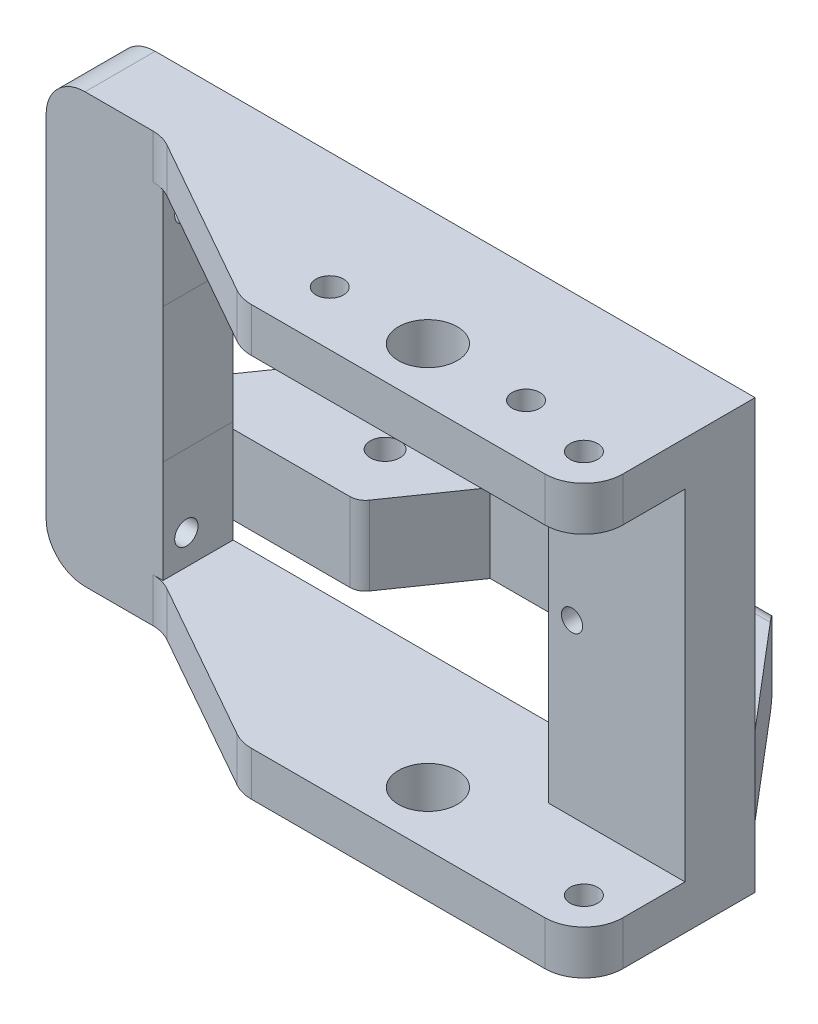
from build123d import *

# Parameters (mm, degrees)
SKETCH1_W               = 114.3
SKETCH1_H               = 69.85
BOSS_EXTRUDE1_DEPTH     = 57.15
SKETCH2_W               = 114.3
SKETCH2_H               = 55.450000124
CUT_EXTRUDE2_DEPTH      = 25.4
SKETCH3_W               = 114.3
SKETCH3_H               = 46.99
CUT_EXTRUDE3_DEPTH      = 20.32
CUT_EXTRUDE6_REACH      = 108.824
SKETCH7_R               = 4.8
CUT_EXTRUDE7_DEPTH      = 75.121121315
CUT_EXTRUDE7_DEPTH_BACK = 75.121121315
SKETCH9_W               = 62.865
SKETCH9_H               = 55.450000124
SKETCH9_W_2             = 19.05
SKETCH9_H_2             = 69.85
CUT_EXTRUDE8_REACH      = 108.824
SKETCH8_R               = 2.25
SKETCH12_R              = 1.905
CUT_EXTRUDE10_DEPTH     = 19.05
SKETCH13_W              = 95.25
SKETCH13_H              = 8.925763794
CUT_EXTRUDE12_DEPTH     = 107.823534392
BOSS_EXTRUDE2_REACH     = 103.269
SKETCH14_W              = 20.32
SKETCH14_H              = 15.660000062
SKETCH5_R               = 2.415
CUT_EXTRUDE20_DEPTH     = 103.326545714
SKETCH18_W              = 20.32
SKETCH18_H              = 10.024904341
CUT_EXTRUDE21_DEPTH     = 113.329404355
BOSS_EXTRUDE4_DEPTH     = 8.89
F_8_CLEARANCE_HOLE1_D   = 4.4958
F_8_32_TAPPED_HOLE1_D   = 3.4544
SKETCH40_W              = 104.14
SKETCH40_H              = 12.835095659
CUT_EXTRUDE22_DEPTH     = 1.27
CUT_EXTRUDE24_DEPTH     = 108.544786288
FILLET3_R               = 6.35
CUT_EXTRUDE25_DEPTH     = 102.320780831
FILLET4_R               = 2.54


with BuildPart() as part:
    # Sketch1 → Boss-Extrude1 (new body)
    with BuildSketch(Plane.XY):
        Rectangle(SKETCH1_W, SKETCH1_H)
    extrude(amount=BOSS_EXTRUDE1_DEPTH)

    # Sketch2 → Cut-Extrude2 (cut)
    with BuildSketch(Plane.XY.offset(57.15)):
        Rectangle(SKETCH2_W, SKETCH2_H)
    extrude(amount=-CUT_EXTRUDE2_DEPTH, mode=Mode.SUBTRACT)

    # Sketch3 → Cut-Extrude3 (cut)
    with BuildSketch(Plane(origin=(0, 0, 0), x_dir=(-1, 0, 0), z_dir=(0, 0, -1))):
        with Locations((0, 11.43)):
            Rectangle(SKETCH3_W, SKETCH3_H)
    extrude(amount=-CUT_EXTRUDE3_DEPTH, mode=Mode.SUBTRACT)

    # Cut-Extrude6: up to this face of the body (flat: up to its plane)
    cut_extrude6_end = Plane(part.part.faces().sort_by_distance((0, 34.925, 38.735))[0])
    # Sketch7 → Cut-Extrude6 (cut, up to the picked face)
    with BuildSketch(Plane.XZ.offset(34.925), mode=Mode.PRIVATE) as cut_extrude6_sk1:
        with Locations((31.75, 39.37)):
            Circle(SKETCH7_R)
    cut_extrude6_tool1 = split(extrude(cut_extrude6_sk1.sketch, amount=-CUT_EXTRUDE6_REACH, mode=Mode.PRIVATE), bisect_by=cut_extrude6_end, keep=Keep.BOTH, mode=Mode.PRIVATE)
    add(cut_extrude6_tool1.solids().sort_by(Axis((31.75, -34.925, 39.37), (0, 1, 0)))[0], mode=Mode.SUBTRACT)

    # Sketch9 → Cut-Extrude7 (cut, two sides: drawn at the far end of the back side and taken through both)
    with BuildSketch(Plane.XY.offset(31.75).offset(-CUT_EXTRUDE7_DEPTH_BACK)):
        with Locations((12.3825, 0)):
            Rectangle(SKETCH9_W, SKETCH9_H)
        with Locations((-47.625, 0)):
            Rectangle(SKETCH9_W_2, SKETCH9_H_2)
    extrude(amount=CUT_EXTRUDE7_DEPTH + CUT_EXTRUDE7_DEPTH_BACK, mode=Mode.SUBTRACT)

    # Sketch8 → Cut-Extrude8 (cut, up to next)
    with BuildSketch(Plane(origin=(0, 34.925, 0), x_dir=(1, 0, 0), z_dir=(0, 1, 0)), mode=Mode.PRIVATE) as cut_extrude8_sk1:
        with Locations(Location((15.75, -39.37, 0), (0, 0, 180))):
            Circle(SKETCH8_R)
    cut_extrude8_tool1 = extrude(cut_extrude8_sk1.sketch, amount=-CUT_EXTRUDE8_REACH, mode=Mode.PRIVATE) & part.part
    # Sketch8 → Cut-Extrude8 (cut, up to next)
    with BuildSketch(Plane(origin=(0, 34.925, 0), x_dir=(1, 0, 0), z_dir=(0, 1, 0)), mode=Mode.PRIVATE) as cut_extrude8_sk2:
        with Locations(Location((47.75, -39.37, 0), (0, 0, 180))):
            Circle(SKETCH8_R)
    cut_extrude8_tool2 = extrude(cut_extrude8_sk2.sketch, amount=-CUT_EXTRUDE8_REACH, mode=Mode.PRIVATE) & part.part
    add(cut_extrude8_tool1.solids().sort_by_distance((15.75, 34.925, 39.37))[0], mode=Mode.SUBTRACT)
    add(cut_extrude8_tool2.solids().sort_by_distance((47.75, 34.925, 39.37))[0], mode=Mode.SUBTRACT)

    # Sketch12 → Cut-Extrude10 (cut)
    with BuildSketch(Plane(origin=(-19.05, 0, 0), x_dir=(0, 0, -1), z_dir=(1, 0, 0))):
        with Locations(Location((-27.94, -22.86, 0), (0, 0, 90))):
            Circle(SKETCH12_R)
        with Locations(Location((-27.94, 22.86, 0), (0, 0, 90))):
            Circle(SKETCH12_R)
    extrude(amount=-CUT_EXTRUDE10_DEPTH, mode=Mode.SUBTRACT)

    # Sketch13 → Cut-Extrude12 (cut, through all)
    with BuildSketch(Plane(origin=(0, 34.925, 0), x_dir=(1, 0, 0), z_dir=(0, 1, 0))):
        with Locations((9.525, -52.687118103)):
            Rectangle(SKETCH13_W, SKETCH13_H)
    extrude(amount=-CUT_EXTRUDE12_DEPTH, mode=Mode.SUBTRACT)

    # Sketch14 → Boss-Extrude2 (add, up to next)
    with BuildSketch(Plane.ZY.offset(-43.815), mode=Mode.PRIVATE) as boss_extrude2_sk1:
        with Locations((10.16, -19.895000031)):
            Rectangle(SKETCH14_W, SKETCH14_H)
    boss_extrude2_tool1 = extrude(boss_extrude2_sk1.sketch, amount=BOSS_EXTRUDE2_REACH, mode=Mode.PRIVATE) - part.part
    add(boss_extrude2_tool1.solids().sort_by_distance((43.815, -19.895, 10.16))[0])

    # Sketch5 → Cut-Extrude20 (cut, through all)
    with BuildSketch(Plane.XZ.offset(34.925)):
        with Locations((-3.81, 10.79)):
            Circle(SKETCH5_R)
        with Locations((46.99, 10.79)):
            Circle(SKETCH5_R)
    extrude(amount=-CUT_EXTRUDE20_DEPTH, mode=Mode.SUBTRACT)

    # Sketch18 → Cut-Extrude21 (cut, through all)
    with BuildSketch(Plane.ZY.offset(38.1)):
        with Locations((10.16, -29.91254783)):
            Rectangle(SKETCH18_W, SKETCH18_H)
    extrude(amount=-CUT_EXTRUDE21_DEPTH, mode=Mode.SUBTRACT)

    # Sketch26 → Boss-Extrude4 (add)
    with BuildSketch(Plane(origin=(57.15, 0, 0), x_dir=(0, 0, -1), z_dir=(1, 0, 0))):
        Polygon((-48.224236206, -34.925), (-20.32, -34.925), (-20.32, -24.900095659), (0, -24.900095659), (0, -12.065), (-20.32, -12.065), (-20.32, 34.925), (-48.224236206, 34.925), (-48.224236206, 27.725000062), (-31.75, 27.725000062), (-31.75, -27.725000062), (-48.224236206, -27.725000062), align=None)
    extrude(amount=BOSS_EXTRUDE4_DEPTH)

    # #8 Clearance Hole1 (through all)
    with Locations(Plane(origin=(0, 34.925, 0), x_dir=(1, 0, 0), z_dir=(0, 1, 0))):
        with Locations((59.69, -41.874236206)):
            Hole(F_8_CLEARANCE_HOLE1_D / 2)

    # #8-32 Tapped Hole1 (through all)
    with Locations(Plane.XY.offset(31.75)):
        with Locations((47.625, 0)):
            Hole(F_8_32_TAPPED_HOLE1_D / 2)

    # Sketch40 → Cut-Extrude22 (cut)
    with BuildSketch(Plane(origin=(0, 0, 0), x_dir=(-1, 0, 0), z_dir=(0, 0, -1))):
        with Locations((-13.97, -18.482547829)):
            Rectangle(SKETCH40_W, SKETCH40_H)
    extrude(amount=-CUT_EXTRUDE22_DEPTH, mode=Mode.SUBTRACT)

    # Sketch47 → Cut-Extrude24 (cut, through all)
    with BuildSketch(Plane(origin=(0, 34.925, 0), x_dir=(1, 0, 0), z_dir=(0, 1, 0))):
        Polygon((-38.1, -31.75), (-19.05, -31.75), (10.16, -48.224236206), (-38.1, -48.224236206), align=None)
    extrude(amount=-CUT_EXTRUDE24_DEPTH, mode=Mode.SUBTRACT)

    # Fillet3
    fillet3_edges = [part.edges().sort_by_distance(p)[0] for p in [
        (-38.1, -34.925, 26.035),
        (66.04, -31.325000031, 48.224236206),
        (66.04, 31.325000031, 48.224236206),
        (10.16, -31.325000031, 48.224236206),
        (10.16, 31.325000031, 48.224236206),
        (-19.05, -31.325000031, 31.75),
        (-19.05, 31.325000031, 31.75),
        (-38.1, 34.925, 26.035),
    ]]
    fillet(fillet3_edges, radius=FILLET3_R)

    # Sketch49 → Cut-Extrude25 (cut, through all)
    with BuildSketch(Plane.XZ.offset(24.900095659)):
        Polygon((-38.1, 20.32), (-32.302770819, 20.32), (-19.050248439, 1.27), (-38.1, 1.27), align=None)
        Polygon((1.32498508, 20.32), (10.16, 7.62), (33.02, 7.62), (43.815, 20.32), align=None)
        Polygon((66.04, 20.32), (49.8475, 1.27), (66.04, 1.27), align=None)
    extrude(amount=-CUT_EXTRUDE25_DEPTH, mode=Mode.SUBTRACT)

    # Fillet4
    fillet4_edges = [part.edges().sort_by_distance(p)[0] for p in [
        (15.398625781, -24.900095659, 1.27),
        (15.398625781, -12.065, 1.27),
        (49.8475, -18.48254783, 1.27),
        (1.32498508, -18.48254783, 20.32),
        (-19.050248439, -18.48254783, 1.27),
        (-32.302770819, -18.48254783, 20.32),
        (33.02, -18.48254783, 7.62),
    ]]
    fillet(fillet4_edges, radius=FILLET4_R)


solid = part.part
